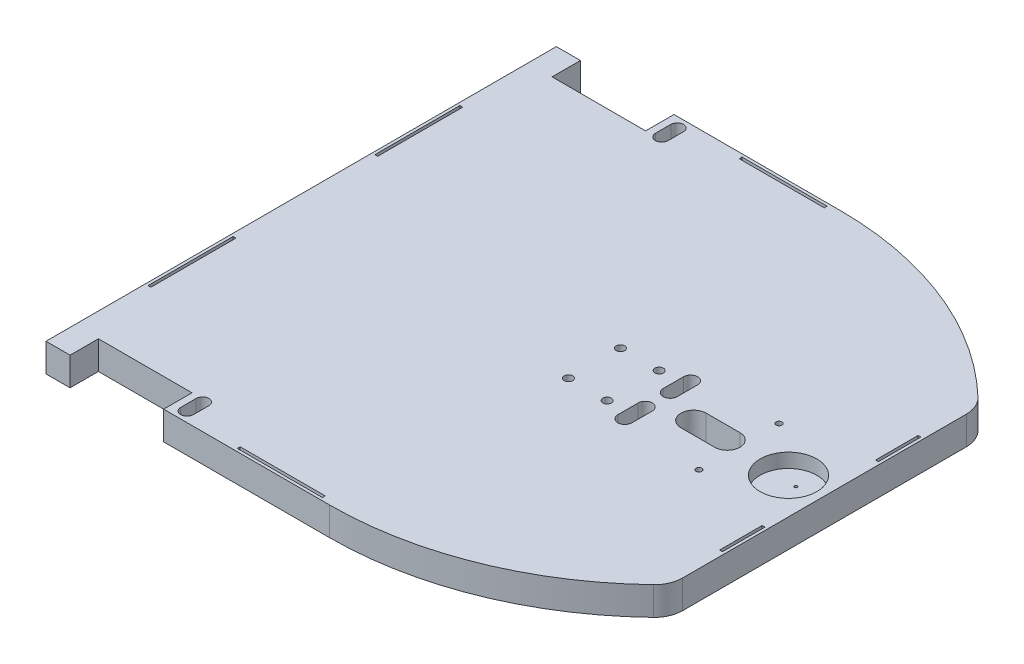
from build123d import *

# Parameters (mm, degrees)
BOSS_EXTRUDE1_DEPTH = 10
SKETCH2_R           = 1
SKETCH2_R_2         = 1.5
SKETCH2_W           = 33
SKETCH2_H           = 10
CUT_EXTRUDE2_DEPTH  = 15
SKETCH3_R           = 10
CUT_EXTRUDE3_DEPTH  = 5
CUT_EXTRUDE4_DEPTH  = 15
SKETCH5_W           = 30
SKETCH5_H           = 1
SKETCH5_W_2         = 1
SKETCH5_H_2         = 30
SKETCH5_H_3         = 15
CUT_EXTRUDE6_DEPTH  = 15
SKETCH6_R           = 0.5
CUT_EXTRUDE7_DEPTH  = 15


with BuildPart() as part:
    # Sketch1 → Boss-Extrude1 (new body)
    with BuildSketch(Plane(origin=(0, 0, 0), x_dir=(1, 0, 0), z_dir=(0, 1, 0))):
        with BuildLine():
            Line((-89.389143795, -90), (-89.389143795, 90))
            Line((-89.389143795, 90), (10.610856205, 90))
            ThreePointArc((10.610856205, 90), (54.533138364, 81.496268076), (92.107774725, 57.214031174))
            ThreePointArc((92.107774725, 57.214031174), (94.381847518, 53.920998768), (95.182620993, 50))
            Line((95.182620993, 50), (95.182620993, -50))
            ThreePointArc((95.182620993, -50), (94.381847518, -53.920998768), (92.107774725, -57.214031174))
            ThreePointArc((92.107774725, -57.214031174), (54.533138364, -81.496268076), (10.610856205, -90))
            Line((10.610856205, -90), (-89.389143795, -90))
        make_face()
    extrude(amount=BOSS_EXTRUDE1_DEPTH)

    # Sketch2 → Cut-Extrude2 (cut, symmetric)
    with BuildSketch(Plane(origin=(0, 10, 0), x_dir=(1, 0, 0), z_dir=(0, 1, 0))):
        with Locations(Location((65, 14.131573434, 0), (0, 0, 90))):
            Circle(SKETCH2_R)
        with Locations(Location((27.688972694, 9.173126615, 0), (0, 0, 90))):
            Circle(SKETCH2_R_2)
        with Locations(Location((14.053243942, 9.173126615, 0), (0, 0, 90))):
            Circle(SKETCH2_R_2)
        with Locations(Location((14.053243942, -9.173126615, 0), (0, 0, 90))):
            Circle(SKETCH2_R_2)
        with Locations(Location((27.688972694, -9.173126615, 0), (0, 0, 90))):
            Circle(SKETCH2_R_2)
        with Locations(Location((65, -14.131573434, 0), (0, 0, 90))):
            Circle(SKETCH2_R)
        with BuildLine():
            Line((-40.968894473, 86.42714575), (-40.968894473, 80.97285425))
            ThreePointArc((-40.968894473, 80.97285425), (-43.204350858, 78.737397865), (-45.439807243, 80.97285425))
            Line((-45.439807243, 80.97285425), (-45.439807243, 86.42714575))
            ThreePointArc((-45.439807243, 86.42714575), (-43.204350858, 88.662602135), (-40.968894473, 86.42714575))
        make_face()
        with BuildLine():
            Line((38.845478036, 11.594873944), (38.845478036, 4.405126056))
            ThreePointArc((38.845478036, 4.405126056), (36.366254627, 1.925902647), (33.887031217, 4.405126056))
            Line((33.887031217, 4.405126056), (33.887031217, 11.594873944))
            ThreePointArc((33.887031217, 11.594873944), (36.366254627, 14.074097353), (38.845478036, 11.594873944))
        make_face()
        with Locations((-64.401012641, 85)):
            Rectangle(SKETCH2_W, SKETCH2_H)
        with BuildLine():
            Line((38.845478036, -11.594873944), (38.845478036, -4.405126056))
            ThreePointArc((38.845478036, -4.405126056), (36.366254627, -1.925902647), (33.887031217, -4.405126056))
            Line((33.887031217, -4.405126056), (33.887031217, -11.594873944))
            ThreePointArc((33.887031217, -11.594873944), (36.366254627, -14.074097353), (38.845478036, -11.594873944))
        make_face()
        with BuildLine():
            Line((-40.968894473, -86.42714575), (-40.968894473, -80.97285425))
            ThreePointArc((-40.968894473, -80.97285425), (-43.204350858, -78.737397865), (-45.439807243, -80.97285425))
            Line((-45.439807243, -80.97285425), (-45.439807243, -86.42714575))
            ThreePointArc((-45.439807243, -86.42714575), (-43.204350858, -88.662602135), (-40.968894473, -86.42714575))
        make_face()
        with Locations((-64.401012641, -85)):
            Rectangle(SKETCH2_W, SKETCH2_H)
    extrude(amount=CUT_EXTRUDE2_DEPTH, both=True, mode=Mode.SUBTRACT)

    # Sketch3 → Cut-Extrude3 (cut, symmetric)
    with BuildSketch(Plane(origin=(0, 10, 0), x_dir=(1, 0, 0), z_dir=(0, 1, 0))):
        with Locations(Location((82.479810043, 0, 0), (0, 0, 270))):
            Circle(SKETCH3_R)
    extrude(amount=CUT_EXTRUDE3_DEPTH, both=True, mode=Mode.SUBTRACT)

    # Sketch4 → Cut-Extrude4 (cut, symmetric)
    with BuildSketch(Plane(origin=(0, 10, 0), x_dir=(1, 0, 0), z_dir=(0, 1, 0))):
        with BuildLine():
            Line((49.010294015, 4.462602137), (60.91056638, 4.462602137))
            ThreePointArc((60.91056638, 4.462602137), (65.373168517, 0), (60.91056638, -4.462602137))
            Line((60.91056638, -4.462602137), (49.010294015, -4.462602137))
            ThreePointArc((49.010294015, -4.462602137), (44.547691878, 0), (49.010294015, 4.462602137))
        make_face()
    extrude(amount=CUT_EXTRUDE4_DEPTH, both=True, mode=Mode.SUBTRACT)

    # Sketch5 → Cut-Extrude6 (cut, symmetric)
    with BuildSketch(Plane(origin=(0, 10, 0), x_dir=(1, 0, 0), z_dir=(0, 1, 0))):
        with Locations((-7.901012641, 88.5)):
            Rectangle(SKETCH5_W, SKETCH5_H)
        with Locations((-87.889143795, 40)):
            Rectangle(SKETCH5_W_2, SKETCH5_H_2)
        with Locations((93.682620993, 27.5)):
            Rectangle(SKETCH5_W_2, SKETCH5_H_3)
        with Locations((93.682620993, -27.5)):
            Rectangle(SKETCH5_W_2, SKETCH5_H_3)
        with Locations((-7.901012641, -88.5)):
            Rectangle(SKETCH5_W, SKETCH5_H)
        with Locations((-87.889143795, -40)):
            Rectangle(SKETCH5_W_2, SKETCH5_H_2)
    extrude(amount=CUT_EXTRUDE6_DEPTH, both=True, mode=Mode.SUBTRACT)

    # Sketch6 → Cut-Extrude7 (cut, symmetric)
    with BuildSketch(Plane(origin=(0, 5, 0), x_dir=(1, 0, 0), z_dir=(0, 1, 0))):
        with Locations(Location((82.244112685, 2.835581496, 0), (0, 0, 270))):
            Circle(SKETCH6_R)
        with Locations(Location((82.244112685, -5.164418504, 0), (0, 0, 270))):
            Circle(SKETCH6_R)
    extrude(amount=CUT_EXTRUDE7_DEPTH, both=True, mode=Mode.SUBTRACT)


solid = part.part
